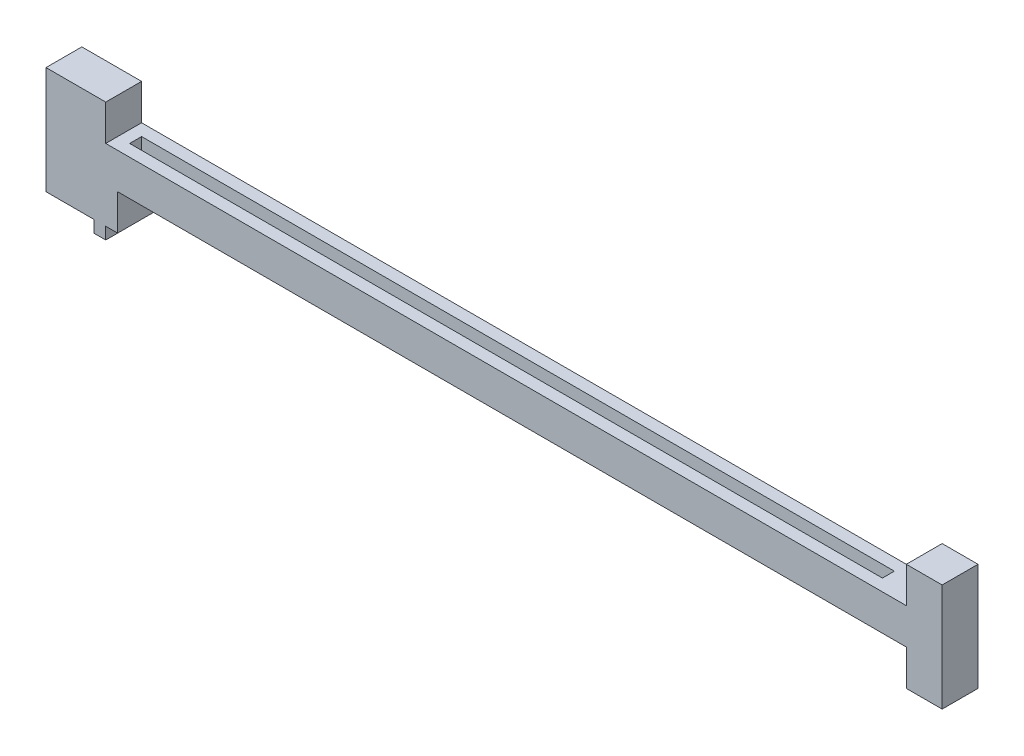
from build123d import *

# Parameters (mm, degrees)
SLIDER_MAIN_BODY_DEPTH = 5
SKETCH2_W              = 1.666666666
SKETCH2_H              = 5
TRACK_SLIDER_DEPTH     = 1.666666667
SKETCH3_W              = 5
SKETCH3_H              = 15
HANDLE_DEPTH           = 5
SKETCH4_W              = 105
SKETCH4_H              = 1.666666666
CUT_EXTRUDE1_DEPTH     = 66.954529791
SKETCH5_W              = 1.666666667
SKETCH5_H              = 5
CUT_EXTRUDE2_DEPTH     = 5


with BuildPart() as part:
    # Sketch1 → Slider Main Body (new body)
    with BuildSketch(Plane.XY):
        Polygon((-55, 7.5), (-55, 2.5), (55, 2.5), (55, 7.5), (60, 7.5), (60, -7.5), (55, -7.5), (55, -2.5), (-55, -2.5), (-55, -7.5), (-60, -7.5), (-60, 7.5), align=None)
    extrude(amount=SLIDER_MAIN_BODY_DEPTH)

    # Sketch2 → Track Slider (add)
    with BuildSketch(Plane.XZ.offset(7.5)):
        with Locations((-57.5, 2.5)):
            Rectangle(SKETCH2_W, SKETCH2_H)
    extrude(amount=TRACK_SLIDER_DEPTH)

    # Sketch3 → Handle (add)
    with BuildSketch(Plane.XY.offset(5)):
        with Locations((-62.5, 0)):
            Rectangle(SKETCH3_W, SKETCH3_H)
    extrude(amount=-HANDLE_DEPTH)

    # Sketch4 → Cut-Extrude1 (cut, through all)
    with BuildSketch(Plane.XZ.offset(2.5)):
        with Locations((-2.5, 2.5)):
            Rectangle(SKETCH4_W, SKETCH4_H)
    extrude(amount=-CUT_EXTRUDE1_DEPTH, mode=Mode.SUBTRACT)

    # Sketch5 → Cut-Extrude2 (cut)
    with BuildSketch(Plane(origin=(0, 7.5, 0), x_dir=(1, 0, 0), z_dir=(0, 1, 0))):
        with Locations((-55.833333334, -2.5)):
            Rectangle(SKETCH5_W, SKETCH5_H)
    extrude(amount=-CUT_EXTRUDE2_DEPTH, mode=Mode.SUBTRACT)


solid = part.part
